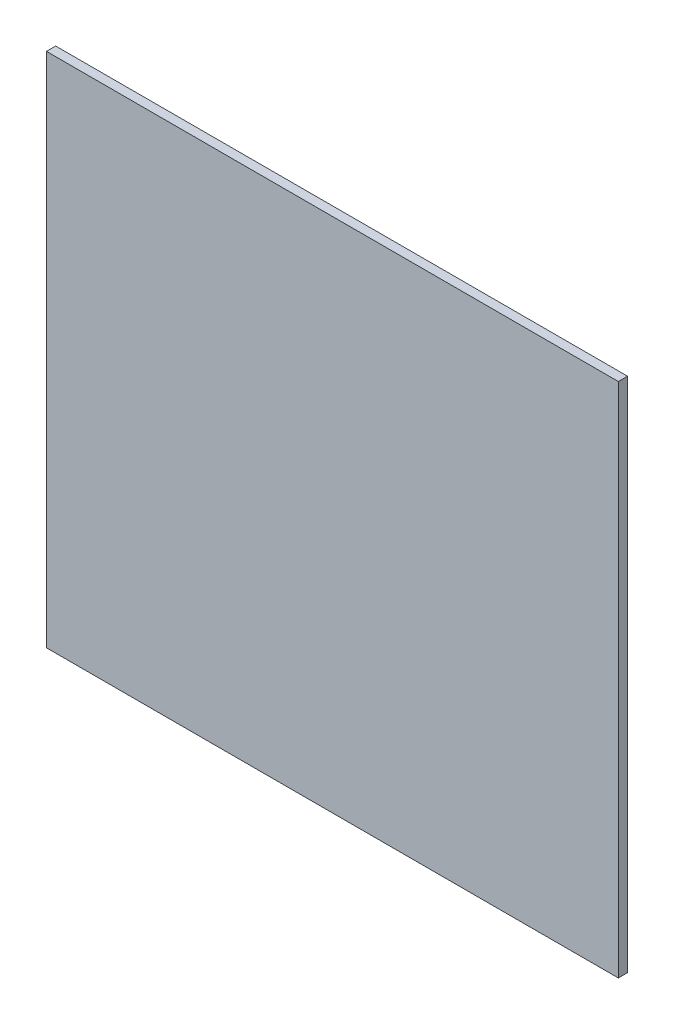
from build123d import *

# Parameters (mm, degrees)
SKIZZE1_W                       = 310
SKIZZE1_H                       = 280
AUFSATZ_LINEAR_AUSTRAGEN1_DEPTH = 5


with BuildPart() as part:
    # Skizze1 → Aufsatz-Linear austragen1 (new body)
    with BuildSketch(Plane.XY):
        Rectangle(SKIZZE1_W, SKIZZE1_H)
    extrude(amount=AUFSATZ_LINEAR_AUSTRAGEN1_DEPTH)


solid = part.part
